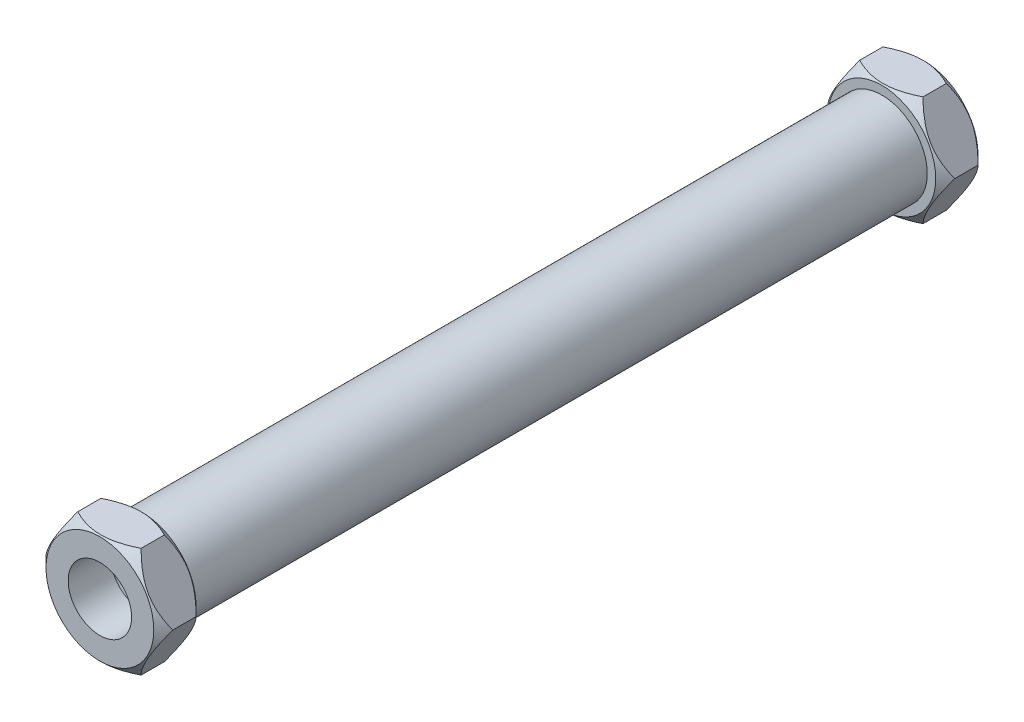
from build123d import *

# Parameters (mm, degrees)
SKETCH1_R                                    = 8.6
SKETCH1_R_2                                  = 6.3
CIRCULAR_HOLLOW_SECTION_C250_AS_17_2X2_DEPTH = 140
SKETCH2_R                                    = 12
BOSS_EXTRUDE1_DEPTH                          = 8
CHAMFER1_SIZE                                = 1.8
SKETCH3_R                                    = 6
CUT_EXTRUDE1_DEPTH                           = 16


with BuildPart() as part:
    # Sketch1 → Circular hollow section (c250) as 17.2X2.3 CHS C250(1) (new body)
    with BuildSketch(Plane(origin=(0, 0, 0), x_dir=(1, 0, 0), z_dir=(0, 0, -1))):
        Circle(SKETCH1_R)
        Circle(SKETCH1_R_2, mode=Mode.SUBTRACT)
    extrude(amount=CIRCULAR_HOLLOW_SECTION_C250_AS_17_2X2_DEPTH)


with BuildPart() as body_2:
    # Sketch2 → Boss-Extrude1 (new body)
    with BuildSketch(Plane.XY):
        Circle(SKETCH2_R)
    extrude(amount=BOSS_EXTRUDE1_DEPTH)

    # Chamfer1
    chamfer1_edges = [body_2.edges().sort_by_distance(p)[0] for p in [
        (-12, 0, 0),
        (-12, 0, 8),
    ]]
    chamfer(chamfer1_edges, length=CHAMFER1_SIZE)

    # Sketch3 → Cut-Extrude1 (cut)
    # profile 1 of 2: a face of its own
    with BuildSketch(Plane.XY.offset(8)):
        Polygon((14.309401077, 0), (7.154700538, 12.392304845), (-7.154700538, 12.392304845), (-14.309401077, 0), (-7.154700538, -12.392304845), (7.154700538, -12.392304845), align=None)
        Polygon((6, -10.392304845), (12, 0), (6, 10.392304845), (-6, 10.392304845), (-12, 0), (-6, -10.392304845), align=None, mode=Mode.SUBTRACT)
    # profile 2 of 2: a face of its own
    with BuildSketch(Plane.XY.offset(8)):
        Circle(SKETCH3_R)
    extrude(amount=-CUT_EXTRUDE1_DEPTH, mode=Mode.SUBTRACT)


with BuildPart() as body_3:
    # Mirror1: mirrored copy
    add(body_2.part.mirror(Plane.XY.offset(-70)))


solid = Compound([part.part, body_2.part, body_3.part])
